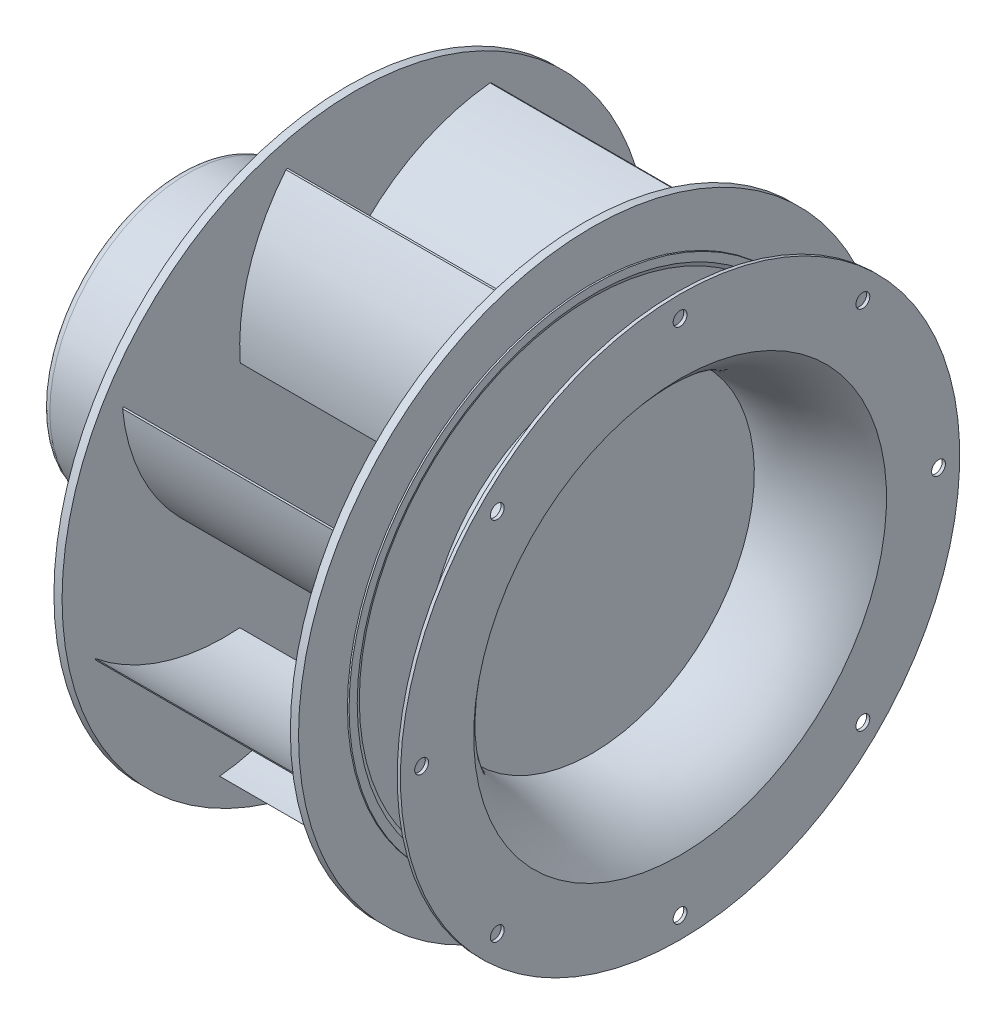
from build123d import *

# Parameters (mm, degrees)
SKETCH2_R         = 180
EXTRUDE1_DEPTH    = 5
SKETCH9_R         = 175
SKETCH9_R_2       = 70
EXTRUDE7_DEPTH    = 3
SKETCH3_R         = 180
EXTRUDE2_DEPTH    = 5
EXTRUDE3_DEPTH    = 145
CIRPATTERN1_COUNT = 8
SKETCH7_R         = 4.25
EXTRUDE5_DEPTH    = 5
CIRPATTERN2_COUNT = 8
SKETCH8_R         = 5
EXTRUDE6_DEPTH    = 69.9
CIRPATTERN3_COUNT = 4


with BuildPart() as part:
    # Sketch1 → Revolve1 (revolve)
    with BuildSketch(Plane.XY, mode=Mode.PRIVATE) as revolve1_sk:
        with BuildLine():
            Line((0, 0), (0, 79.5))
            ThreePointArc((0, 79.5), (1.464466094, 83.035533906), (5, 84.5))
            Line((5, 84.5), (56, 84.5))
            Line((56, 84.5), (56, 108.5))
            Line((56, 108.5), (69.9, 108.5))
            Line((69.9, 108.5), (69.9, 68.5))
            Line((69.9, 68.5), (74.9, 68.5))
            Line((74.9, 68.5), (74.9, 103.5))
            Line((74.9, 103.5), (84.9, 103.5))
            Line((84.9, 103.5), (84.9, 68.5))
            Line((84.9, 68.5), (103, 68.5))
            Line((103, 68.5), (103, 0))
            Line((103, 0), (0, 0))
        make_face()
    revolve(revolve1_sk.sketch.rotate(Axis((0, 0, 0), (1, 0, 0)), 90), axis=Axis((0, 0, 0), (1, 0, 0)))

    # Sketch2 → Extrude1 (add)
    with BuildSketch(Plane(origin=(103, 0, 0), x_dir=(0, 0, -1), z_dir=(1, 0, 0))):
        Circle(SKETCH2_R)
    extrude(amount=EXTRUDE1_DEPTH)

    # Sketch9 → Extrude7 (cut)
    with BuildSketch(Plane.ZY.offset(-103)):
        Circle(SKETCH9_R)
        Circle(SKETCH9_R_2, mode=Mode.SUBTRACT)
    extrude(amount=-EXTRUDE7_DEPTH, mode=Mode.SUBTRACT)



with BuildPart() as body_2:
    # Sketch3 → Extrude2 (new body)
    with BuildSketch(Plane(origin=(248, 0, 0), x_dir=(0, 0, -1), z_dir=(1, 0, 0))):
        Circle(SKETCH3_R)
    extrude(amount=EXTRUDE2_DEPTH)


with BuildPart() as part_1:
    add(part.part)

    add(body_2.part)  # Extrude3 merges body 2
    # Sketch4 → Extrude3 (add)
    with BuildSketch(Plane(origin=(108, 0, 0), x_dir=(0, 0, -1), z_dir=(1, 0, 0))):
        with BuildLine():
            Line((0, 100), (0.866025404, 99.5))
            ThreePointArc((0.866025404, 99.5), (37.979123721, 128.903753251), (83.366025404, 142.394191624))
            Line((83.366025404, 142.394191624), (82.5, 142.894191624))
            ThreePointArc((82.5, 142.894191624), (37.113098317, 129.403753251), (0, 100))
        make_face()
    extrude3 = extrude(amount=EXTRUDE3_DEPTH)

    # CirPattern1: Extrude3 ×8 about axis
    cirpattern1_axis = Axis((0, 0, 0), (1, 0, 0))
    for i in range(1, CIRPATTERN1_COUNT):
        add(extrude3.rotate(cirpattern1_axis, i * 360 / CIRPATTERN1_COUNT))

    # Sketch5 → Revolve2 (revolve)
    with BuildSketch(Plane.XY, mode=Mode.PRIVATE) as revolve2_sk:
        with BuildLine():
            Line((253, 150), (254, 150))
            Line((254, 150), (254, 145))
            ThreePointArc((254, 145), (248.600588794, 124.025252556), (251, 102.5))
            Line((251, 102.5), (251, 101.5))
            ThreePointArc((251, 101.5), (247.914400029, 123.437843677), (253, 145))
            Line((253, 145), (253, 150))
        make_face()
    revolve(revolve2_sk.sketch.rotate(Axis((0, 0, 0), (1, 0, 0)), 90), axis=Axis((0, 0, 0), (1, 0, 0)))

    # Sketch8 → Extrude6 (cut)
    with BuildSketch(Plane(origin=(0, 0, 0), x_dir=(0, 0, -1), z_dir=(1, 0, 0))):
        with Locations(Location((0, 95, 0), (0, 0, 180))):
            Circle(SKETCH8_R)
    extrude6 = extrude(amount=EXTRUDE6_DEPTH, mode=Mode.SUBTRACT)

    # CirPattern3: Extrude6 ×4 about axis
    cirpattern3_axis = Axis((0, 0, 0), (1, 0, 0))
    for i in range(1, CIRPATTERN3_COUNT):
        add(extrude6.rotate(cirpattern3_axis, i * 360 / CIRPATTERN3_COUNT), mode=Mode.SUBTRACT)


with BuildPart() as body_2_2:
    # Sketch6 → Revolve3 (revolve)
    with BuildSketch(Plane.XY, mode=Mode.PRIVATE) as revolve3_sk:
        with BuildLine():
            Line((307, 171.5), (305, 171.5))
            Line((305, 171.5), (305, 126.6))
            ThreePointArc((305, 126.6), (281.481813227, 108.336048031), (252.5, 101.5))
            Line((252.5, 101.5), (248.5, 101.5))
            Line((248.5, 101.5), (248.5, 99.5))
            Line((248.5, 99.5), (252.5, 99.5))
            ThreePointArc((252.5, 99.5), (282.849606698, 106.816473615), (307, 126.6))
            Line((307, 126.6), (307, 171.5))
        make_face()
    revolve(revolve3_sk.sketch.rotate(Axis((0, 0, 0), (1, 0, 0)), 180), axis=Axis((0, 0, 0), (1, 0, 0)))

    # Sketch7 → Extrude5 (cut)
    with BuildSketch(Plane(origin=(307, 0, 0), x_dir=(0, 0, -1), z_dir=(1, 0, 0))):
        with Locations((0, 158.5)):
            Circle(SKETCH7_R)
    extrude5 = extrude(amount=-EXTRUDE5_DEPTH, mode=Mode.SUBTRACT)

    # CirPattern2: Extrude5 ×8 about axis
    cirpattern2_axis = Axis((0, 0, 0), (1, 0, 0))
    for i in range(1, CIRPATTERN2_COUNT):
        add(extrude5.rotate(cirpattern2_axis, i * 360 / CIRPATTERN2_COUNT), mode=Mode.SUBTRACT)


solid = Compound([part_1.part, body_2_2.part])
